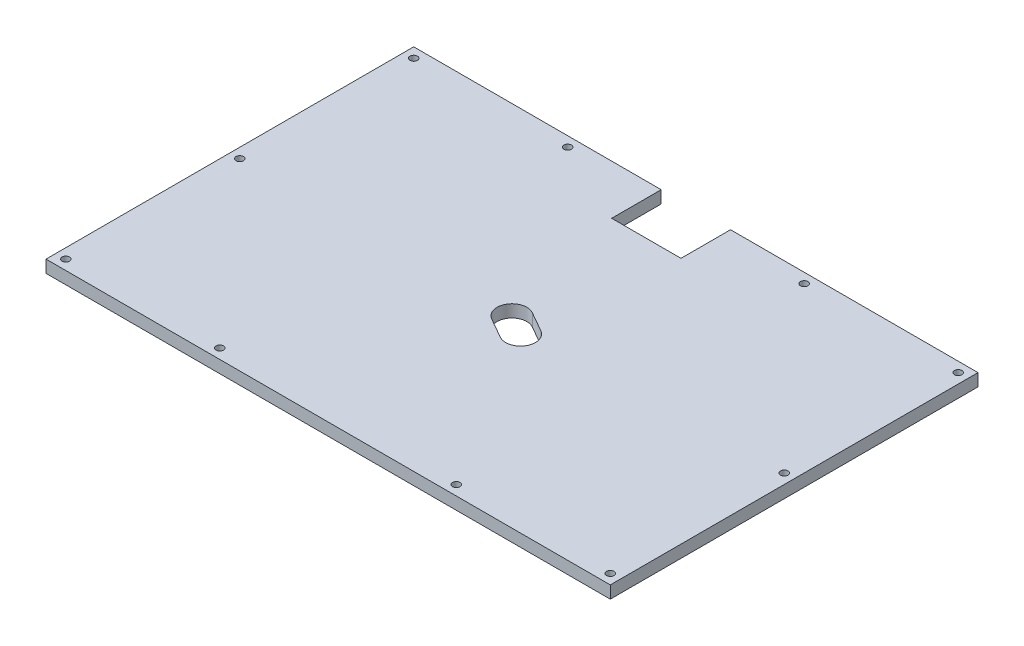
from build123d import *

# Parameters (mm, degrees)
SKETCH1_R           = 1.5
BOSS_EXTRUDE1_DEPTH = 5


with BuildPart() as part:
    # Sketch1 → Boss-Extrude1 (new body)
    with BuildSketch(Plane(origin=(0, 0, 0), x_dir=(1, 0, 0), z_dir=(0, 1, 0))):
        Polygon((0, 0), (0, 148.48), (99.93, 148.48), (99.93, 128.48), (127.93, 128.48), (127.93, 148.48), (227.86, 148.48), (227.86, 0), align=None)
        with Locations(Location((223.86, 74.24, 0), (0, 0, 270))):
            Circle(SKETCH1_R, mode=Mode.SUBTRACT)
        with Locations(Location((4, 74.24, 0), (0, 0, 90))):
            Circle(SKETCH1_R, mode=Mode.SUBTRACT)
        with Locations(Location((66.18, 4, 0), (0, 0, 270))):
            Circle(SKETCH1_R, mode=Mode.SUBTRACT)
        with Locations(Location((161.68, 4, 0), (0, 0, 270))):
            Circle(SKETCH1_R, mode=Mode.SUBTRACT)
        with Locations(Location((161.68, 144.48, 0), (0, 0, 270))):
            Circle(SKETCH1_R, mode=Mode.SUBTRACT)
        with Locations(Location((66.18, 144.48, 0), (0, 0, 270))):
            Circle(SKETCH1_R, mode=Mode.SUBTRACT)
        with Locations(Location((223.86, 4, 0), (0, 0, 270))):
            Circle(SKETCH1_R, mode=Mode.SUBTRACT)
        with Locations(Location((4, 4, 0), (0, 0, 90))):
            Circle(SKETCH1_R, mode=Mode.SUBTRACT)
        with Locations(Location((4, 144.48, 0), (0, 0, 270))):
            Circle(SKETCH1_R, mode=Mode.SUBTRACT)
        with Locations(Location((223.86, 144.48, 0), (0, 0, 90))):
            Circle(SKETCH1_R, mode=Mode.SUBTRACT)
        with BuildLine():
            Line((124.972729238, 74.848802076), (116.902729238, 79.451802076))
            ThreePointArc((116.902729238, 79.451802076), (108.718197924, 77.212729238), (110.957270762, 69.028197924))
            Line((110.957270762, 69.028197924), (119.027270762, 64.425197924))
            ThreePointArc((119.027270762, 64.425197924), (127.211802076, 66.664270762), (124.972729238, 74.848802076))
        make_face(mode=Mode.SUBTRACT)
    extrude(amount=BOSS_EXTRUDE1_DEPTH)


solid = part.part
